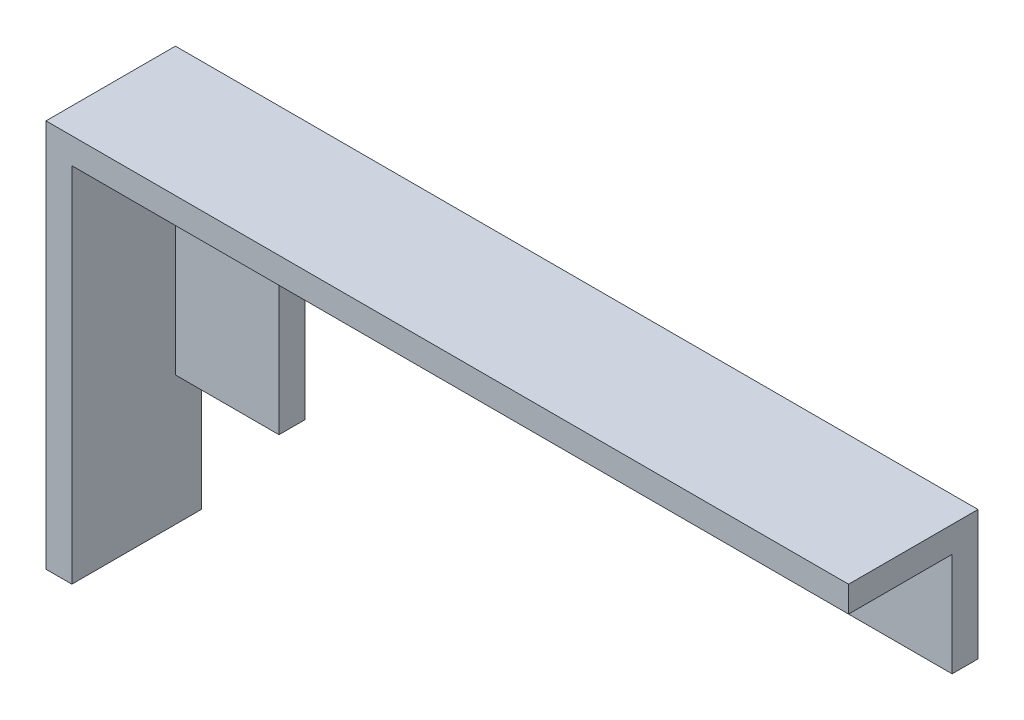
from build123d import *

# Parameters (mm, degrees)
BOSS_EXTRU_1_DEPTH      = 5
ENL_V_MAT_EXTRU_1_DEPTH = 4


with BuildPart() as part:
    # Esquisse1 → Boss.-Extru.1 (new body)
    with BuildSketch(Plane.XY):
        Polygon((0, 0), (31, 0), (31, -5), (5, -5), (5, -10), (1, -10), (1, -15), (0, -15), align=None)
    extrude(amount=BOSS_EXTRU_1_DEPTH)

    # Esquisse2 → Enlèv. mat.-Extru.1 (cut)
    with BuildSketch(Plane.XY.offset(5)):
        Polygon((1, -10), (1, -1), (31, -1), (31, -5), (5, -5), (5, -10), align=None)
    extrude(amount=-ENL_V_MAT_EXTRU_1_DEPTH, mode=Mode.SUBTRACT)


solid = part.part
